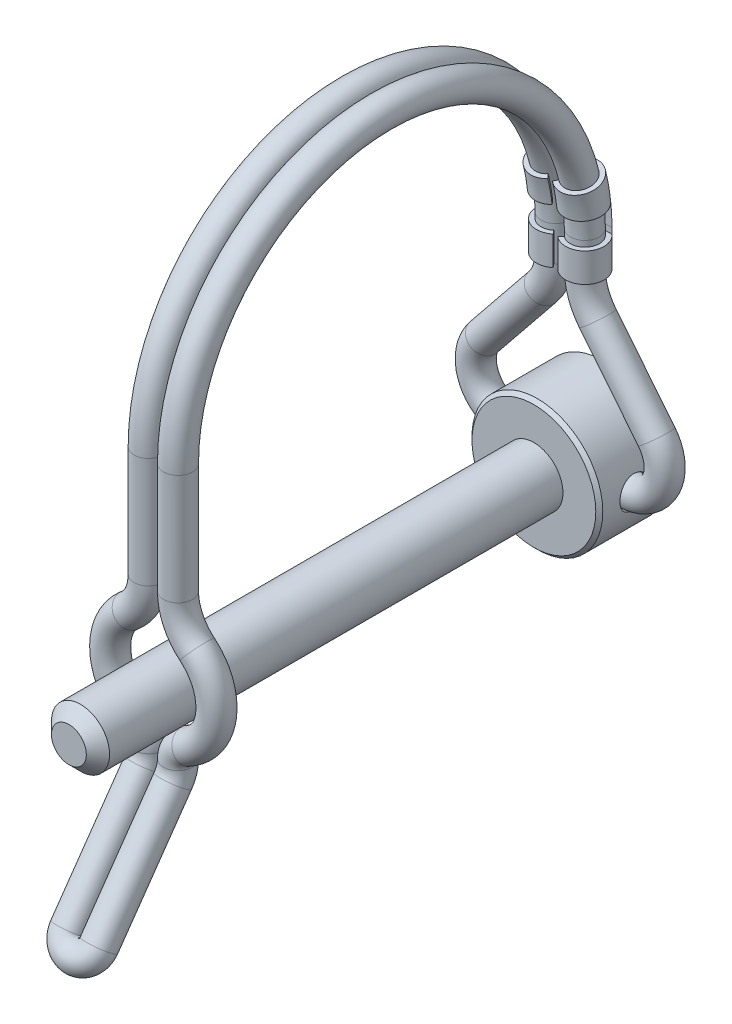
from build123d import *

# Parameters (mm, degrees)
CUT_EXTRUDE1_DEPTH      = 32.057846105
CUT_EXTRUDE1_DEPTH_BACK = 32.057846105
SKETCH2_R               = 1.7145
SKETCH7_R               = 1.5875
CUT_EXTRUDE2_DEPTH      = 57.327130708
CUT_EXTRUDE2_DEPTH_BACK = 57.327130708


with BuildPart() as part:
    # Sketch1 → Revolve1 (revolve)
    with BuildSketch(Plane(origin=(0, 0, 0), x_dir=(0, 0, -1), z_dir=(1, 0, 0)), mode=Mode.PRIVATE) as revolve1_sk:
        Polygon((-29.36875, 0), (29.36875, 0), (29.36875, 6.76275), (28.98775, 7.14375), (21.81225, 7.14375), (21.43125, 6.76275), (21.43125, 3.175), (-28.09875, 3.175), (-29.36875, 1.905), align=None)
    revolve(revolve1_sk.sketch.rotate(Axis((0, 0, 29.36875), (0, 0, -1)), 90), axis=Axis((0, 0, 29.36875), (0, 0, -1)))

    # Sketch2 → Cut-Extrude1 (cut, two sides: drawn at the far end of the back side and taken through both)
    with BuildSketch(Plane(origin=(0, 0, 0), x_dir=(0, 0, -1), z_dir=(1, 0, 0)).offset(-CUT_EXTRUDE1_DEPTH_BACK)):
        with Locations((25.4, 0)):
            Circle(SKETCH2_R)
    extrude(amount=CUT_EXTRUDE1_DEPTH + CUT_EXTRUDE1_DEPTH_BACK, mode=Mode.SUBTRACT)


with BuildPart() as body_2:
    # Sweep1: sweep along a curve in space
    with BuildLine() as sweep1_path:
        Line((-1.6002, 22.225, -25.4), (-1.6002, 19.05, -25.4))
        Line((-1.6002, 19.05, -25.4), (-1.6002, 18.415, -25.4))
        ThreePointArc((-1.6002, 18.415, -25.4), (-1.962754015, 16.300055421, -25.4), (-3.009015928, 14.426616873, -25.4))
        Line((-3.009015928, 14.426616873, -25.4), (-9.438240045, 6.461489454, -25.4))
        ThreePointArc((-9.438240045, 6.461489454, -25.4), (-9.93078457, 2.257329997, -25.4), (-6.35, 0, -25.4))
        Line((-6.35, 0, -25.4), (6.35, 0, -25.4))
        ThreePointArc((6.35, 0, -25.4), (9.93078457, 2.257329997, -25.4), (9.438240045, 6.461489454, -25.4))
        Line((9.438240045, 6.461489454, -25.4), (3.009015928, 14.426616873, -25.4))
        ThreePointArc((3.009015928, 14.426616873, -25.4), (1.962754015, 16.300055421, -25.4), (1.6002, 18.415, -25.4))
        Line((1.6002, 18.415, -25.4), (1.6002, 19.05, -25.4))
        Line((1.6002, 19.05, -25.4), (1.6002, 22.225, -25.4))
        ThreePointArc((1.6002, 22.225, -25.4), (1.6002, 44.45, -3.175), (1.6002, 22.225, 19.05))
        Line((1.6002, 22.225, 19.05), (1.6002, 15.875, 19.05))
        Line((1.6002, 15.875, 19.05), (1.6002, 10.16, 19.05))
        ThreePointArc((1.6002, 10.16, 19.05), (2.152298855, 7.688705733, 19.05), (3.703614671, 5.687324275, 19.05))
        ThreePointArc((3.703614671, 5.687324275, 19.05), (5.774426296, 0.600164441, 19.05), (2.679415307, -3.937275691, 19.05))
        ThreePointArc((2.679415307, -3.937275691, 19.05), (1.891123014, -4.675167153, 19.05), (1.6002, -5.715, 19.05))
        ThreePointArc((1.6002, -5.715, 19.05), (1.6002, -6.669740913, 19.196948681), (1.6002, -7.536105185, 19.624192259))
        Line((1.6002, -7.536105185, 19.624192259), (1.6002, -19.05, 27.686308203))
        ThreePointArc((1.6002, -19.05, 27.686308203), (0, -20.360807101, 28.604145216), (-1.6002, -19.05, 27.686308203))
        Line((-1.6002, -19.05, 27.686308203), (-1.6002, -7.536105185, 19.624192259))
        ThreePointArc((-1.6002, -7.536105185, 19.624192259), (-1.6002, -6.669740913, 19.196948681), (-1.6002, -5.715, 19.05))
        ThreePointArc((-1.6002, -5.715, 19.05), (-1.891123014, -4.675167153, 19.05), (-2.679415307, -3.937275691, 19.05))
        ThreePointArc((-2.679415307, -3.937275691, 19.05), (-5.774426296, 0.600164441, 19.05), (-3.703614671, 5.687324275, 19.05))
        ThreePointArc((-3.703614671, 5.687324275, 19.05), (-2.152298855, 7.688705733, 19.05), (-1.6002, 10.16, 19.05))
        Line((-1.6002, 10.16, 19.05), (-1.6002, 15.875, 19.05))
        Line((-1.6002, 15.875, 19.05), (-1.6002, 22.225, 19.05))
        ThreePointArc((-1.6002, 22.225, 19.05), (-1.6002, 44.45, -3.175), (-1.6002, 22.225, -25.4))
    # Sketch7 → Sweep1 (sweep)
    with BuildSketch(Plane(origin=(0, 0, 0), x_dir=(0, 0, -1), z_dir=(1, 0, 0))):
        with Locations((25.4, 0)):
            Circle(SKETCH7_R)
    sweep(path=sweep1_path.line)


with BuildPart() as body_3:
    # Sweep2: sweep along a path in Sketch12
    with BuildLine(Plane(origin=(0, 0, 0), x_dir=(0, 0, -1), z_dir=(1, 0, 0))) as sweep2_path:
        Line((26.9875, 18.415), (26.9875, 22.225))
        ThreePointArc((26.9875, 22.225), (26.814420568, 25.09082474), (26.297698304, 27.914989401))
    # Sketch13 → Sweep2 (sweep)
    with BuildSketch(Plane(origin=(0, 18.415, 0), x_dir=(-1, 0, 0), z_dir=(0, -1, 0))):
        with BuildLine():
            Line((1.6002, 26.9875), (-1.6002, 26.9875))
            ThreePointArc((-1.6002, 26.9875), (-3.092090742, 24.85739677), (-0.580351515, 24.183420649))
            Line((-0.580351515, 24.183420649), (-0.254, 23.794115256))
            ThreePointArc((-0.254, 23.794115256), (-3.569495779, 24.683763737), (-1.6002, 27.4955))
            Line((-1.6002, 27.4955), (1.6002, 27.4955))
            ThreePointArc((1.6002, 27.4955), (3.569495779, 24.683763737), (0.254, 23.794115256))
            Line((0.254, 23.794115256), (0.580351515, 24.183420649))
            ThreePointArc((0.580351515, 24.183420649), (3.092090742, 24.85739677), (1.6002, 26.9875))
        make_face()
    sweep(path=sweep2_path.line)

    # Sketch14 → Cut-Extrude2 (cut, two sides: drawn at the far end of the back side and taken through both)
    with BuildSketch(Plane(origin=(0, 0, 0), x_dir=(0, 0, -1), z_dir=(1, 0, 0)).offset(-CUT_EXTRUDE2_DEPTH_BACK)):
        with BuildLine():
            Line((26.9875, 21.59), (3.175, 21.59))
            Line((3.175, 21.59), (3.175, 22.225))
            Line((3.175, 22.225), (26.849906761, 24.781158467))
            ThreePointArc((26.849906761, 24.781158467), (26.953076809, 23.504929491), (26.9875, 22.225))
            Line((26.9875, 22.225), (26.9875, 21.59))
        make_face()
    extrude(amount=CUT_EXTRUDE2_DEPTH + CUT_EXTRUDE2_DEPTH_BACK, mode=Mode.SUBTRACT)


solid = Compound([part.part, body_2.part, body_3.part])
